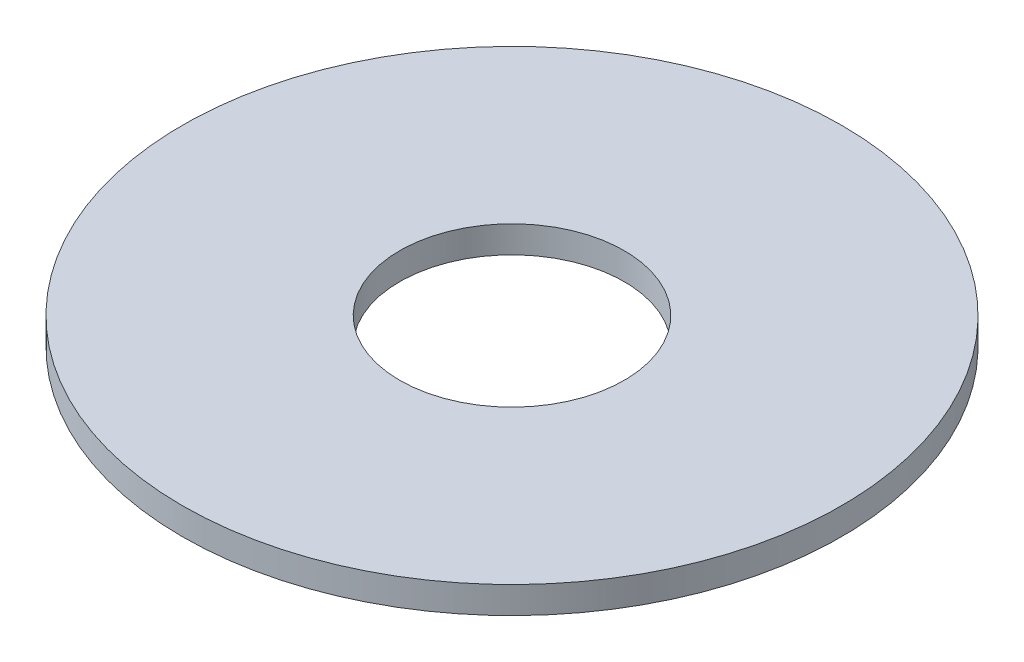
from build123d import *

# Parameters (mm, degrees)
SKETCH_1_R      = 49
SKETCH_1_R_2    = 16.7
EXTRUDE_1_DEPTH = 4


with BuildPart() as part:
    # Эскиз1 → Бобышка-Вытянуть1 (new body)
    with BuildSketch(Plane(origin=(0, 0, 0), x_dir=(1, 0, 0), z_dir=(0, 1, 0))):
        with Locations(Location((0, 0, 0), (0, 0, 270))):
            Circle(SKETCH_1_R)
        with Locations(Location((0, 0, 0), (0, 0, 270))):
            Circle(SKETCH_1_R_2, mode=Mode.SUBTRACT)
    extrude(amount=EXTRUDE_1_DEPTH)


solid = part.part
